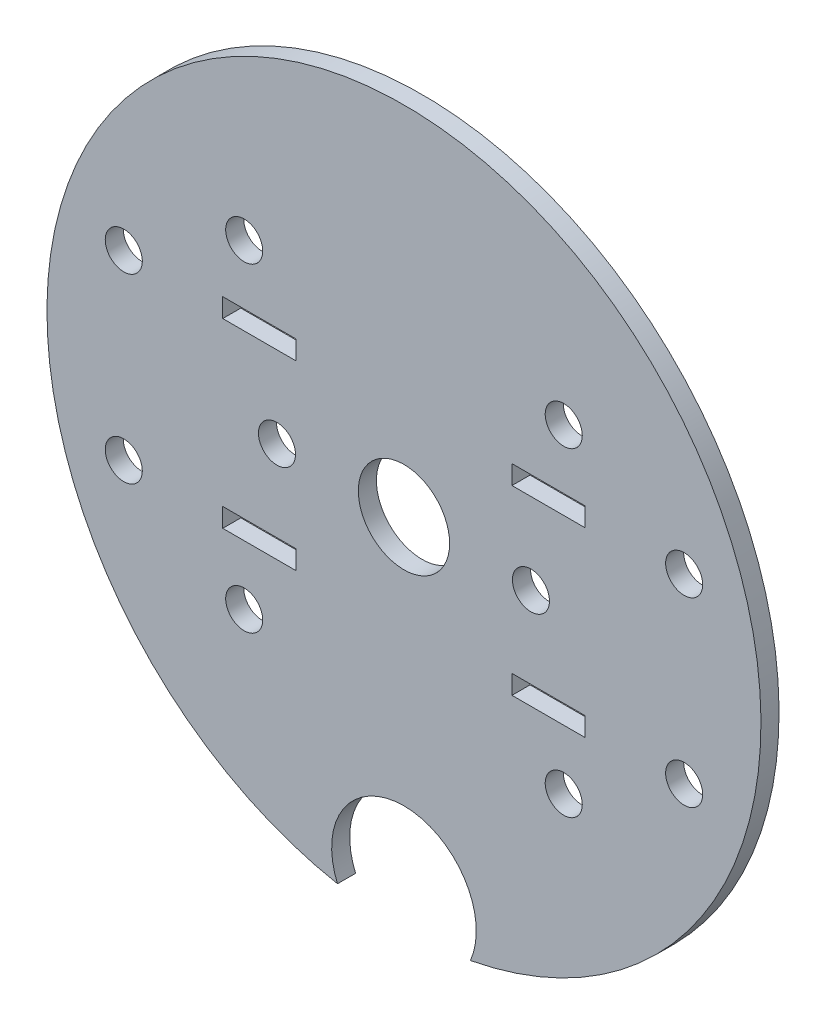
from build123d import *

# Parameters (mm, degrees)
SKETCH_1_R      = 5.05
SKETCH_1_R_2    = 2.05
SKETCH_1_W      = 8.1
SKETCH_1_H      = 2.1
EXTRUDE_1_DEPTH = 2


with BuildPart() as part:
    # 草图1 → 凸台-拉伸1 (new body)
    with BuildSketch(Plane.XY):
        with BuildLine():
            ThreePointArc((-7.35497191, -38.809204942), (0, 39.5), (7.35497191, -38.809204942))
            ThreePointArc((7.35497191, -38.809204942), (0, -27.662081143), (-7.35497191, -38.809204942))
        make_face()
        Circle(SKETCH_1_R, mode=Mode.SUBTRACT)
        with Locations((-17.67766953, -17.67766953)):
            Circle(SKETCH_1_R_2, mode=Mode.SUBTRACT)
        with Locations((-17.67766953, 17.67766953)):
            Circle(SKETCH_1_R_2, mode=Mode.SUBTRACT)
        with Locations((17.67766953, 17.67766953)):
            Circle(SKETCH_1_R_2, mode=Mode.SUBTRACT)
        with Locations((17.67766953, -17.67766953)):
            Circle(SKETCH_1_R_2, mode=Mode.SUBTRACT)
        with Locations((31, 10.05)):
            Circle(SKETCH_1_R_2, mode=Mode.SUBTRACT)
        with Locations(Location((31, -10.05, 0), (0, 0, 180))):
            Circle(SKETCH_1_R_2, mode=Mode.SUBTRACT)
        with Locations((-31, -10.05)):
            Circle(SKETCH_1_R_2, mode=Mode.SUBTRACT)
        with Locations(Location((-31, 10.05, 0), (0, 0, 180))):
            Circle(SKETCH_1_R_2, mode=Mode.SUBTRACT)
        with Locations((-14.05, 0)):
            Circle(SKETCH_1_R_2, mode=Mode.SUBTRACT)
        with Locations(Location((14.05, 0, 0), (0, 0, 180))):
            Circle(SKETCH_1_R_2, mode=Mode.SUBTRACT)
        with Locations((16, -10.05)):
            Rectangle(SKETCH_1_W, SKETCH_1_H, mode=Mode.SUBTRACT)
        with Locations((16, 10.05)):
            Rectangle(SKETCH_1_W, SKETCH_1_H, mode=Mode.SUBTRACT)
        with Locations((-16, 10.05)):
            Rectangle(SKETCH_1_W, SKETCH_1_H, mode=Mode.SUBTRACT)
        with Locations((-16, -10.05)):
            Rectangle(SKETCH_1_W, SKETCH_1_H, mode=Mode.SUBTRACT)
    extrude(amount=EXTRUDE_1_DEPTH)


solid = part.part
